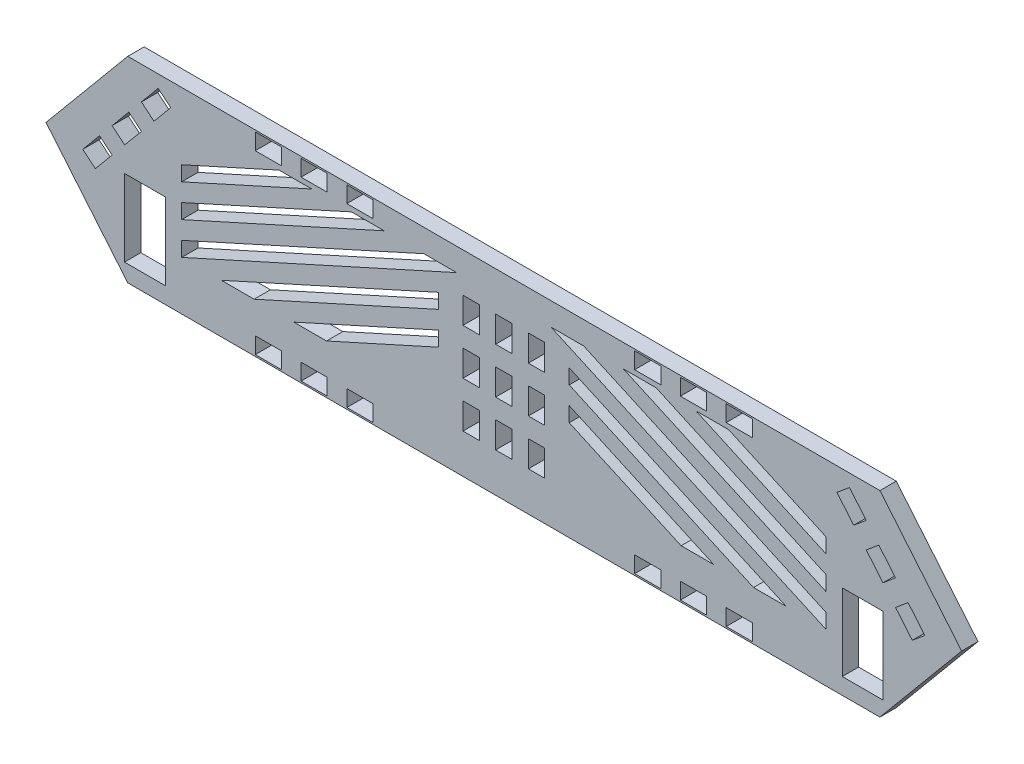
from build123d import *

# Parameters (mm, degrees)
SKETCH_1_W      = 12.5
SKETCH_1_H      = 23.5
SKETCH_1_W_2    = 5
SKETCH_1_H_2    = 8
SKETCH_1_W_3    = 8
SKETCH_1_H_3    = 5
EXTRUDE_1_DEPTH = 5


with BuildPart() as part:
    # 草图1 → 凸台-拉伸1 (new body)
    with BuildSketch(Plane.XY):
        Polygon((140, 0), (115, -30), (-115, -30), (-140, 0), (-115, 30), (115, 30), align=None)
        Polygon((-105.700921998, 26.158893602), (-110.822397196, 20.013123365), (-106.981290798, 16.812201367), (-101.8598156, 22.957971604), align=None, mode=Mode.SUBTRACT)
        Polygon((-114.663503594, 15.403795688), (-119.784978791, 9.258025451), (-115.943872393, 6.057103453), (-110.822397196, 12.202873689), align=None, mode=Mode.SUBTRACT)
        Polygon((-123.626085189, 4.648697773), (-128.747560386, -1.497072463), (-124.906453988, -4.697994462), (-119.784978791, 1.447775775), align=None, mode=Mode.SUBTRACT)
        Polygon((-98.5, -0.47150647), (-46.579460947, 23), (-36.579460947, 23), (-98.5, -4.992165712), (-98.5, -3), align=None, mode=Mode.SUBTRACT)
        with Locations((-109.75, -13.25)):
            Rectangle(SKETCH_1_W, SKETCH_1_H, mode=Mode.SUBTRACT)
        Rectangle(SKETCH_1_W_2, SKETCH_1_H_2, mode=Mode.SUBTRACT)
        with Locations((0, 14)):
            Rectangle(SKETCH_1_W_2, SKETCH_1_H_2, mode=Mode.SUBTRACT)
        with Locations((0, -14)):
            Rectangle(SKETCH_1_W_2, SKETCH_1_H_2, mode=Mode.SUBTRACT)
        Polygon((-98.5, -10.479340758), (-24.441463471, 23), (-14.441463471, 23), (-98.5, -15), align=None, mode=Mode.SUBTRACT)
        Polygon((-20, 15), (-86.362002523, -15), (-76.362002523, -15), (-20, 10.479340758), align=None, mode=Mode.SUBTRACT)
        Polygon((-20, 4.992165712), (-64.224005046, -15), (-54.224005046, -15), (-20, 0.47150647), align=None, mode=Mode.SUBTRACT)
        Polygon((-58.717458424, 23), (-68.717458424, 23), (-98.5, 9.536327819), (-98.5, 5.015668577), align=None, mode=Mode.SUBTRACT)
        Polygon((98.5, 5.015668577), (58.717458424, 23), (68.717458424, 23), (98.5, 9.536327819), align=None, mode=Mode.SUBTRACT)
        Polygon((20, 0.47150647), (20, 4.992165712), (64.224005046, -15), (54.224005046, -15), align=None, mode=Mode.SUBTRACT)
        Polygon((98.5, -15), (98.5, -10.479340758), (24.441463471, 23), (14.441463471, 23), align=None, mode=Mode.SUBTRACT)
        Polygon((20, 10.479340758), (20, 15), (86.362002523, -15), (76.362002523, -15), align=None, mode=Mode.SUBTRACT)
        Polygon((98.5, -0.47150647), (98.5, -3), (98.5, -4.992165712), (36.579460947, 23), (46.579460947, 23), align=None, mode=Mode.SUBTRACT)
        with Locations((109.75, -13.25)):
            Rectangle(SKETCH_1_W, SKETCH_1_H, mode=Mode.SUBTRACT)
        Polygon((119.784978791, 1.447775775), (124.906453988, -4.697994462), (128.747560386, -1.497072463), (123.626085189, 4.648697773), align=None, mode=Mode.SUBTRACT)
        Polygon((110.822397196, 12.202873689), (115.943872393, 6.057103453), (119.784978791, 9.258025451), (114.663503594, 15.403795688), align=None, mode=Mode.SUBTRACT)
        Polygon((101.8598156, 22.957971604), (106.981290798, 16.812201367), (110.822397196, 20.013123365), (105.700921998, 26.158893602), align=None, mode=Mode.SUBTRACT)
        with Locations((-10, 0)):
            Rectangle(SKETCH_1_W_2, SKETCH_1_H_2, mode=Mode.SUBTRACT)
        with Locations((-10, 14)):
            Rectangle(SKETCH_1_W_2, SKETCH_1_H_2, mode=Mode.SUBTRACT)
        with Locations((-10, -14)):
            Rectangle(SKETCH_1_W_2, SKETCH_1_H_2, mode=Mode.SUBTRACT)
        with Locations((10, -14)):
            Rectangle(SKETCH_1_W_2, SKETCH_1_H_2, mode=Mode.SUBTRACT)
        with Locations((10, 14)):
            Rectangle(SKETCH_1_W_2, SKETCH_1_H_2, mode=Mode.SUBTRACT)
        with Locations((10, 0)):
            Rectangle(SKETCH_1_W_2, SKETCH_1_H_2, mode=Mode.SUBTRACT)
        with Locations((-58, 27)):
            Rectangle(SKETCH_1_W_3, SKETCH_1_H_3, mode=Mode.SUBTRACT)
        with Locations((-72, 27)):
            Rectangle(SKETCH_1_W_3, SKETCH_1_H_3, mode=Mode.SUBTRACT)
        with Locations((-44, 27)):
            Rectangle(SKETCH_1_W_3, SKETCH_1_H_3, mode=Mode.SUBTRACT)
        with Locations((58, -27)):
            Rectangle(SKETCH_1_W_3, SKETCH_1_H_3, mode=Mode.SUBTRACT)
        with Locations((72, -27)):
            Rectangle(SKETCH_1_W_3, SKETCH_1_H_3, mode=Mode.SUBTRACT)
        with Locations((44, 27)):
            Rectangle(SKETCH_1_W_3, SKETCH_1_H_3, mode=Mode.SUBTRACT)
        with Locations((58, 27)):
            Rectangle(SKETCH_1_W_3, SKETCH_1_H_3, mode=Mode.SUBTRACT)
        with Locations((72, 27)):
            Rectangle(SKETCH_1_W_3, SKETCH_1_H_3, mode=Mode.SUBTRACT)
        with Locations((44, -27)):
            Rectangle(SKETCH_1_W_3, SKETCH_1_H_3, mode=Mode.SUBTRACT)
        with Locations((-44, -27)):
            Rectangle(SKETCH_1_W_3, SKETCH_1_H_3, mode=Mode.SUBTRACT)
        with Locations((-58, -27)):
            Rectangle(SKETCH_1_W_3, SKETCH_1_H_3, mode=Mode.SUBTRACT)
        with Locations((-72, -27)):
            Rectangle(SKETCH_1_W_3, SKETCH_1_H_3, mode=Mode.SUBTRACT)
    extrude(amount=EXTRUDE_1_DEPTH)


solid = part.part
